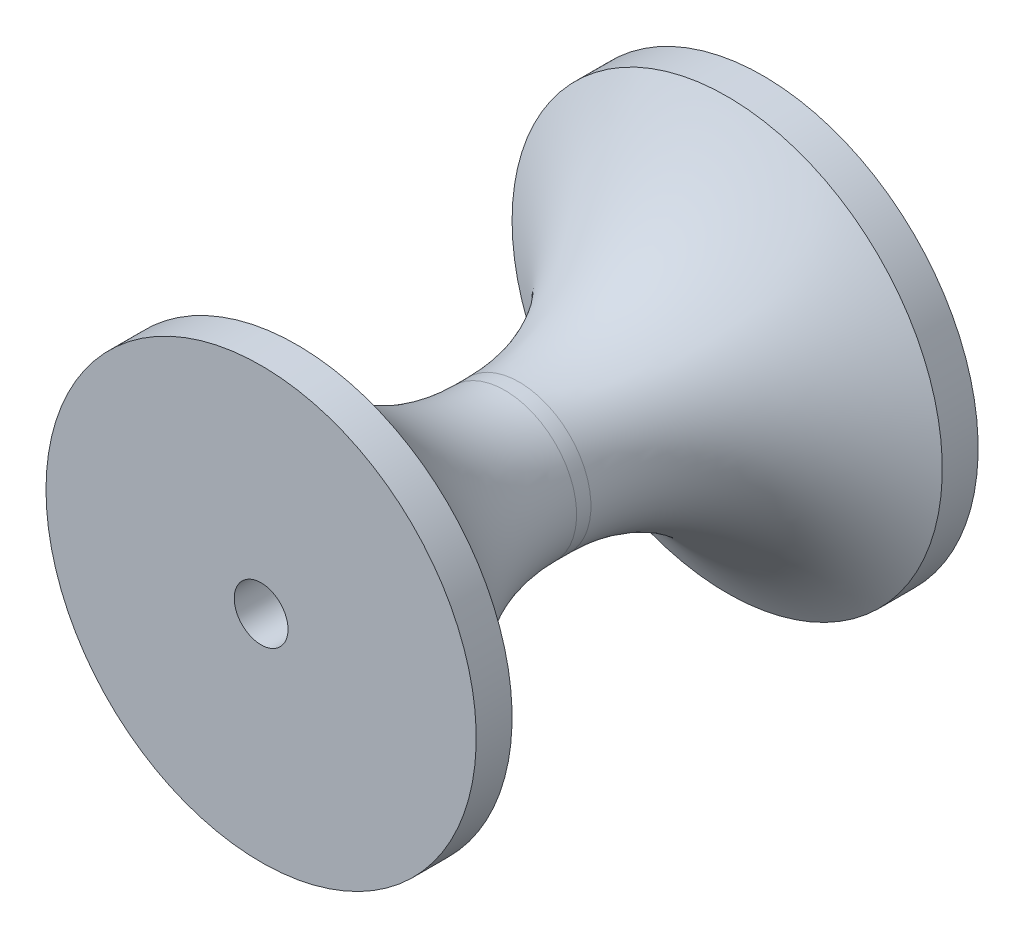
from build123d import *

# Parameters (mm, degrees)
CUT_EXTRUDE1_DEPTH      = 70.850000109
CUT_EXTRUDE1_DEPTH_BACK = 70.850000109
SKETCH2_R               = 4.7625


with BuildPart() as part:
    # Sketch1 → Revolve1 (revolve)
    with BuildSketch(Plane(origin=(0, 0, 0), x_dir=(0, 0, -1), z_dir=(1, 0, 0)), mode=Mode.PRIVATE) as revolve1_sk:
        with BuildLine():
            Line((0, 0), (0, 12.7))
            Line((0, 12.7), (1.27, 12.7))
            add(Edge.make_bspline(
                [(1.27, 12.7), (23.639666793, 12.7), (38.1, 38.1)],
                knots=[0, 0, 0, 1, 1, 1], degree=2))
            Line((38.1, 38.1), (44.45, 38.1))
            Line((44.45, 38.1), (44.45, 0))
            Line((44.45, 0), (0, 0))
        make_face()
    revolve1 = revolve(revolve1_sk.sketch.rotate(Axis((0, 0, -51.236845644), (0, 0, 1)), 90), axis=Axis((0, 0, -51.236845644), (0, 0, 1)))

    # Mirror1: Revolve1 across plane
    add(revolve1.mirror(Plane.XY))

    # Sketch2 → Cut-Extrude1 (cut, two sides: drawn at the far end of the back side and taken through both)
    with BuildSketch(Plane.XY.offset(-CUT_EXTRUDE1_DEPTH_BACK)):
        Circle(SKETCH2_R)
    extrude(amount=CUT_EXTRUDE1_DEPTH + CUT_EXTRUDE1_DEPTH_BACK, mode=Mode.SUBTRACT)


solid = part.part
